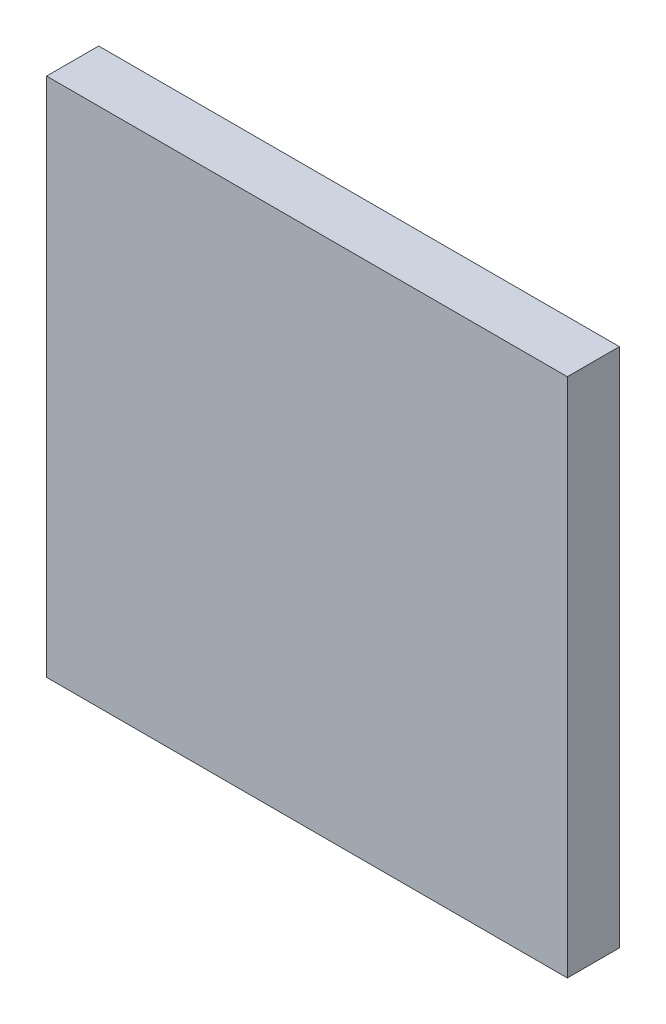
from build123d import *

# Parameters (mm, degrees)
SKETCH_1_W      = 100
SKETCH_1_H      = 100
EXTRUDE_1_DEPTH = 10


with BuildPart() as part:
    # 草图1 → 凸台-拉伸1 (new body)
    with BuildSketch(Plane.XY):
        Rectangle(SKETCH_1_W, SKETCH_1_H)
    extrude(amount=EXTRUDE_1_DEPTH)


solid = part.part
